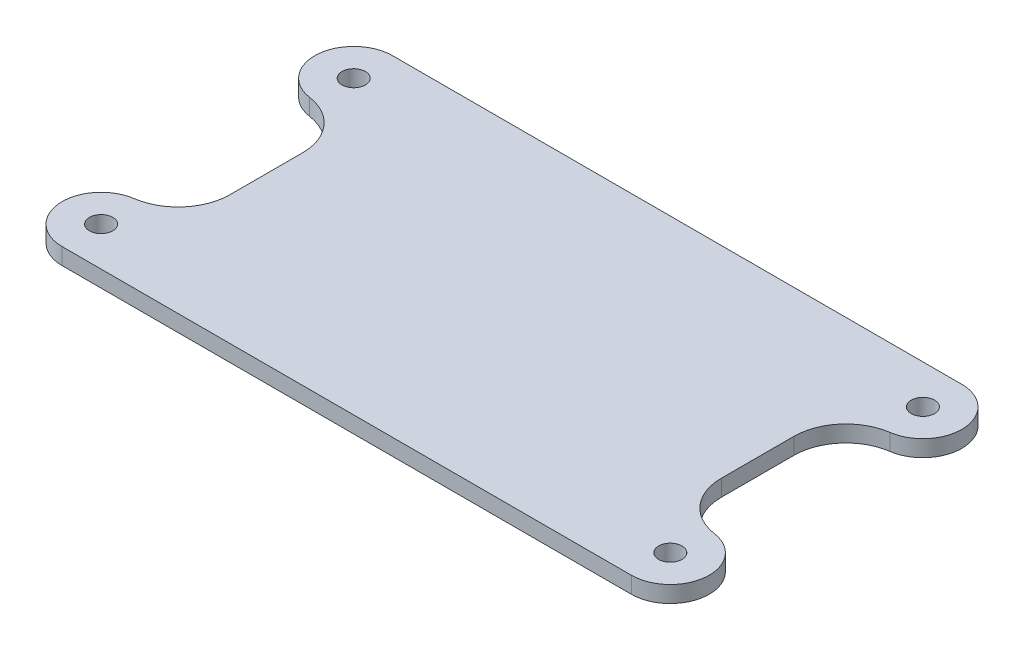
from build123d import *

# Parameters (mm, degrees)
SKETCH1_R           = 2.2479
BOSS_EXTRUDE1_DEPTH = 1.5875


with BuildPart() as part:
    # Sketch1 → Boss-Extrude1 (new, symmetric)
    with BuildSketch(Plane(origin=(0, 0, 0), x_dir=(1, 0, 0), z_dir=(0, 1, 0))):
        with BuildLine():
            Line((-47.25, 6.976491924), (-47.25, -6.976491924))
            ThreePointArc((-47.25, -6.976491924), (-49.69071054, -13.523028631), (-55.821428571, -16.87392511))
            ThreePointArc((-55.821428571, -16.87392511), (-60.419467095, -19.38709747), (-62.25, -24.297))
            ThreePointArc((-62.25, -24.297), (-60.053300859, -29.600300859), (-54.75, -31.797))
            Line((-54.75, -31.797), (54.75, -31.797))
            ThreePointArc((54.75, -31.797), (60.053300859, -29.600300859), (62.25, -24.297))
            ThreePointArc((62.25, -24.297), (60.419467095, -19.38709747), (55.821428571, -16.87392511))
            ThreePointArc((55.821428571, -16.87392511), (49.69071054, -13.523028631), (47.25, -6.976491924))
            Line((47.25, -6.976491924), (47.25, 6.976491924))
            ThreePointArc((47.25, 6.976491924), (49.69071054, 13.523028631), (55.821428571, 16.87392511))
            ThreePointArc((55.821428571, 16.87392511), (60.419467095, 19.38709747), (62.25, 24.297))
            ThreePointArc((62.25, 24.297), (60.053300859, 29.600300859), (54.75, 31.797))
            Line((54.75, 31.797), (-54.75, 31.797))
            ThreePointArc((-54.75, 31.797), (-60.053300859, 29.600300859), (-62.25, 24.297))
            ThreePointArc((-62.25, 24.297), (-60.419467095, 19.38709747), (-55.821428571, 16.87392511))
            ThreePointArc((-55.821428571, 16.87392511), (-49.69071054, 13.523028631), (-47.25, 6.976491924))
        make_face()
        with Locations(Location((54.75, 24.297, 0), (0, 0, 270))):
            Circle(SKETCH1_R, mode=Mode.SUBTRACT)
        with Locations(Location((54.75, -24.297, 0), (0, 0, 270))):
            Circle(SKETCH1_R, mode=Mode.SUBTRACT)
        with Locations(Location((-54.75, -24.297, 0), (0, 0, 270))):
            Circle(SKETCH1_R, mode=Mode.SUBTRACT)
        with Locations(Location((-54.75, 24.297, 0), (0, 0, 270))):
            Circle(SKETCH1_R, mode=Mode.SUBTRACT)
    extrude(amount=BOSS_EXTRUDE1_DEPTH, both=True)


solid = part.part
